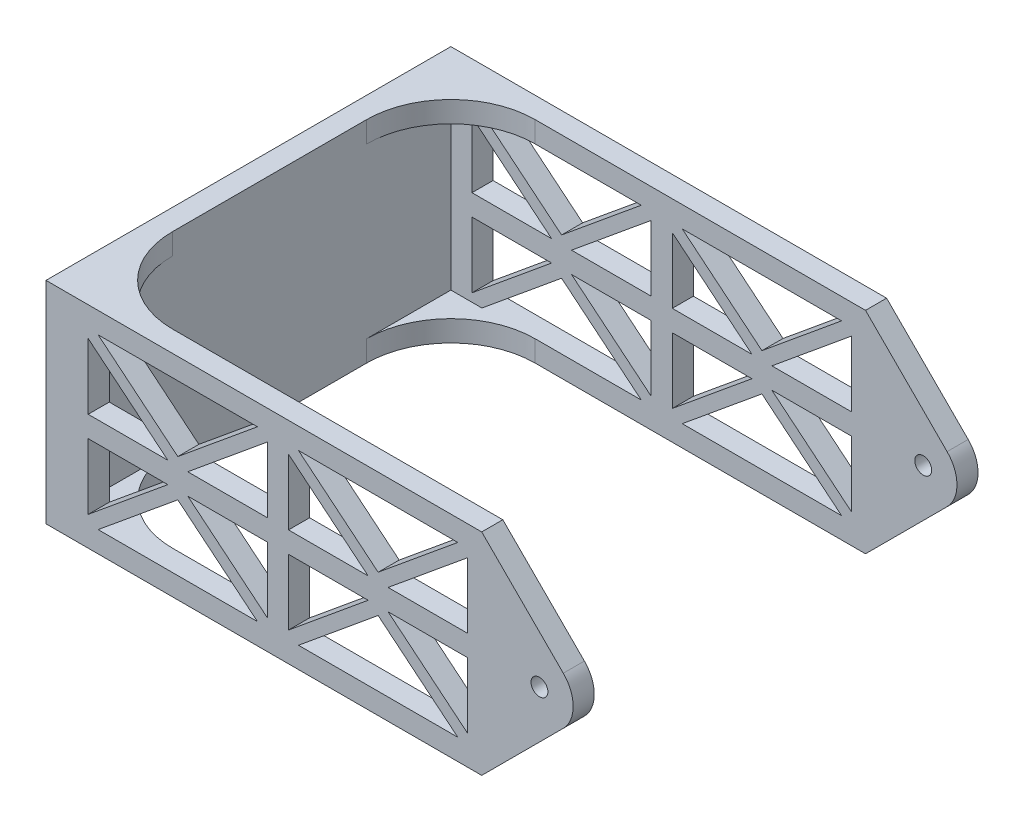
from build123d import *

# Parameters (mm, degrees)
BOSS_EXTRUDE1_DEPTH  = 50
SKETCH2_R            = 2
CUT_EXTRUDE1_DEPTH   = 166.351141514
CUT_EXTRUDE2_DEPTH   = 10
BOSS_EXTRUDE3_DEPTH  = 5
MIRROR5_COPY_1_DEPTH = 5


with BuildPart() as part:
    # Sketch1 → Boss-Extrude1 (new body)
    with BuildSketch(Plane(origin=(0, 0, 0), x_dir=(1, 0, 0), z_dir=(0, 1, 0))):
        Polygon((0, 0), (125, 0), (125, 5), (5, 5), (5, 91), (125, 91), (125, 96), (0, 96), align=None)
    extrude(amount=BOSS_EXTRUDE1_DEPTH)

    # Sketch2 → Cut-Extrude1 (cut, through all)
    with BuildSketch(Plane.XY):
        with Locations((117, 25)):
            Circle(SKETCH2_R)
    extrude(amount=-CUT_EXTRUDE1_DEPTH, mode=Mode.SUBTRACT)

    # Sketch3 → Cut-Extrude2 (cut)
    with BuildSketch(Plane.XY):
        Polygon((52.5, 43.056819217), (33.609576666, 27.5), (52.5, 27.5), align=None)
        Polygon((50.140423334, 45), (12.359576666, 45), (31.25, 29.443180783), align=None)
        Polygon((28.890423334, 27.5), (10, 43.056819217), (10, 27.5), align=None)
        Polygon((10, 6.943180783), (28.890423334, 22.5), (10, 22.5), align=None)
        Polygon((12.359576666, 5), (50.140423334, 5), (31.25, 20.556819217), align=None)
        Polygon((52.5, 6.943180783), (52.5, 22.5), (33.609576666, 22.5), align=None)
        Polygon((57.5, 6.943180783), (76.390423334, 22.5), (57.5, 22.5), align=None)
        Polygon((59.859576666, 5), (97.640423334, 5), (78.75, 20.556819217), align=None)
        Polygon((81.109576666, 22.5), (100, 6.943180783), (100, 22.5), align=None)
        Polygon((100, 43.056819217), (81.109576666, 27.5), (100, 27.5), align=None)
        Polygon((97.640423334, 45), (59.859576666, 45), (78.75, 29.443180783), align=None)
        Polygon((76.390423334, 27.5), (57.5, 43.056819217), (57.5, 27.5), align=None)
        with BuildLine():
            Line((103.313708499, 50), (122.656854249, 30.656854249))
            ThreePointArc((122.656854249, 30.656854249), (124.39103626, 28.061467459), (125, 25))
            Line((125, 25), (125, 50))
            Line((125, 50), (103.313708499, 50))
        make_face()
        with BuildLine():
            Line((125, 0), (125, 25))
            ThreePointArc((125, 25), (124.39103626, 21.938532541), (122.656854249, 19.343145751))
            Line((122.656854249, 19.343145751), (103.313708499, 0))
            Line((103.313708499, 0), (125, 0))
        make_face()
    cut_extrude2 = extrude(amount=-CUT_EXTRUDE2_DEPTH, mode=Mode.SUBTRACT)

    # Mirror3: Cut-Extrude2 across plane
    add(cut_extrude2.mirror(Plane.XY.offset(-48)), mode=Mode.SUBTRACT)

    # Sketch6 → Boss-Extrude3 (add)
    with BuildSketch(Plane(origin=(0, 50, 0), x_dir=(1, 0, 0), z_dir=(0, 1, 0))):
        with BuildLine():
            Line((5, 5), (25, 5))
            ThreePointArc((25, 5), (10.857864376, 10.857864376), (5, 25))
            Line((5, 25), (5, 5))
        make_face()
    boss_extrude3 = extrude(amount=-BOSS_EXTRUDE3_DEPTH)

    # Mirror4: Boss-Extrude3 across plane
    add(boss_extrude3.mirror(Plane.ZX.offset(25)))

    # Mirror5: Boss-Extrude3 across plane
    add(boss_extrude3.mirror(Plane.XY.offset(-48)))

    # Mirror5 copy 1 sketch → Mirror5 copy 1 (add)
    with BuildSketch(Plane(origin=(0, 0, -96), x_dir=(1, 0, 0), z_dir=(0, -1, 0))):
        with BuildLine():
            Line((5, 5), (25, 5))
            ThreePointArc((25, 5), (10.857864376, 10.857864376), (5, 25))
            Line((5, 25), (5, 5))
        make_face()
    extrude(amount=-MIRROR5_COPY_1_DEPTH)


solid = part.part
